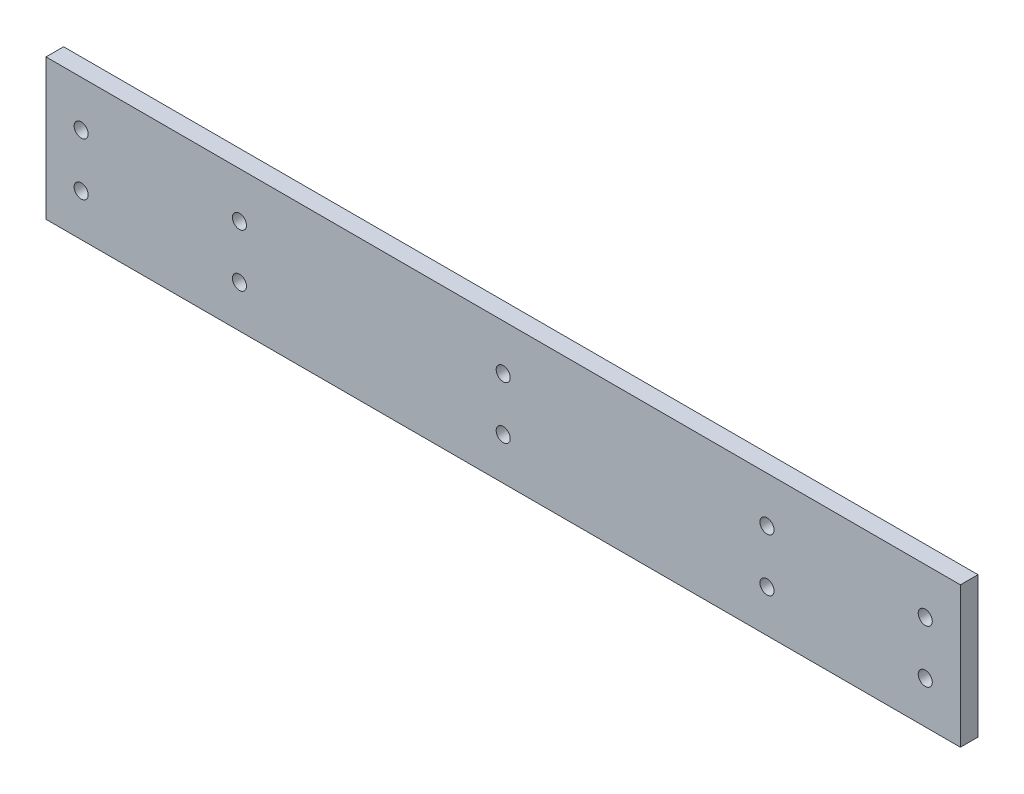
from build123d import *

# Parameters (mm, degrees)
ESQUISSE1_W             = 260
ESQUISSE1_H             = 40
BOSS_EXTRU_1_DEPTH      = 5
ESQUISSE2_R             = 2
ENL_V_MAT_EXTRU_1_DEPTH = 5


with BuildPart() as part:
    # Esquisse1 → Boss.-Extru.1 (new body)
    with BuildSketch(Plane.XY):
        with Locations((130, -20)):
            Rectangle(ESQUISSE1_W, ESQUISSE1_H)
    extrude(amount=BOSS_EXTRU_1_DEPTH)

    # Esquisse2 → Enlèv. mat.-Extru.1 (cut)
    with BuildSketch(Plane.XY.offset(5)):
        with Locations((10, -13)):
            Circle(ESQUISSE2_R)
        with Locations((10, -28)):
            Circle(ESQUISSE2_R)
        with Locations((250, -28)):
            Circle(ESQUISSE2_R)
        with Locations((250, -13)):
            Circle(ESQUISSE2_R)
        with Locations((205, -28)):
            Circle(ESQUISSE2_R)
        with Locations((205, -13)):
            Circle(ESQUISSE2_R)
        with Locations((55, -13)):
            Circle(ESQUISSE2_R)
        with Locations((55, -28)):
            Circle(ESQUISSE2_R)
        with Locations((130, -13)):
            Circle(ESQUISSE2_R)
        with Locations((130, -28)):
            Circle(ESQUISSE2_R)
    extrude(amount=-ENL_V_MAT_EXTRU_1_DEPTH, mode=Mode.SUBTRACT)


solid = part.part
